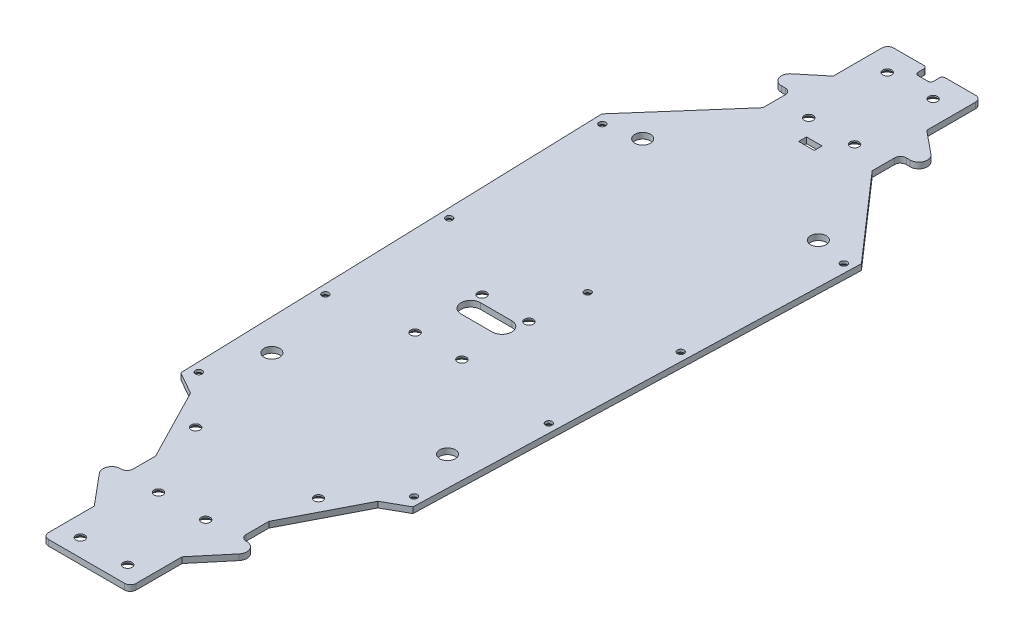
from build123d import *

# Parameters (mm, degrees)
RESSALTO_EXTRUS_O1_DEPTH             = 3
ESBO_O2_R                            = 4
CORTE_EXTRUS_O1_DEPTH                = 10
ESCAREADO_PARA_SFHCS_M31_AT_2_COUNT  = 2
ESCAREADO_PARA_SFHCS_M31_AT_2_PITCH  = 110.302460898
ESCAREADO_PARA_SFHCS_M31_AT_3_COUNT  = 2
ESCAREADO_PARA_SFHCS_M31_AT_3_PITCH  = 130.842986965
ESCAREADO_PARA_SFHCS_M31_AT_4_COUNT  = 2
ESCAREADO_PARA_SFHCS_M31_AT_4_PITCH  = 67
ESCAREADO_PARA_SFHCS_M31_AT_5_COUNT  = 2
ESCAREADO_PARA_SFHCS_M31_AT_5_PITCH  = 132.532334398
ESCAREADO_PARA_SFHCS_M31_AT_6_COUNT  = 2
ESCAREADO_PARA_SFHCS_M31_AT_6_PITCH  = 175.070818678
ESCAREADO_PARA_SFHCS_M31_AT_7_COUNT  = 2
ESCAREADO_PARA_SFHCS_M31_AT_7_PITCH  = 213.572320447
ESCAREADO_PARA_SFHCS_M31_AT_8_COUNT  = 2
ESCAREADO_PARA_SFHCS_M31_AT_8_PITCH  = 243.433045731
ESCAREADO_PARA_SFHCS_M31_AT_9_COUNT  = 2
ESCAREADO_PARA_SFHCS_M31_AT_9_PITCH  = 142.710342559
ESCAREADO_PARA_SFHCS_M41_AT_2_COUNT  = 2
ESCAREADO_PARA_SFHCS_M41_AT_2_PITCH  = 40
ESCAREADO_PARA_SFHCS_M41_AT_3_COUNT  = 2
ESCAREADO_PARA_SFHCS_M41_AT_3_PITCH  = 46.75082887
ESCAREADO_PARA_SFHCS_M41_AT_4_COUNT  = 2
ESCAREADO_PARA_SFHCS_M41_AT_4_PITCH  = 24.2
ESCAREADO_PARA_SFHCS_M41_AT_5_COUNT  = 2
ESCAREADO_PARA_SFHCS_M41_AT_5_PITCH  = 58.077850276
ESCAREADO_PARA_SFHCS_M41_AT_6_COUNT  = 2
ESCAREADO_PARA_SFHCS_M41_AT_6_PITCH  = 43.020334562
ESCAREADO_PARA_SFHCS_M41_AT_7_COUNT  = 2
ESCAREADO_PARA_SFHCS_M41_AT_7_PITCH  = 136.807623633
ESCAREADO_PARA_SFHCS_M41_AT_8_COUNT  = 2
ESCAREADO_PARA_SFHCS_M41_AT_8_PITCH  = 139.831145131
ESCAREADO_PARA_SFHCS_M41_AT_9_COUNT  = 2
ESCAREADO_PARA_SFHCS_M41_AT_9_PITCH  = 173.161507104
ESCAREADO_PARA_SFHCS_M41_AT_10_COUNT = 2
ESCAREADO_PARA_SFHCS_M41_AT_10_PITCH = 170.775968029
ESCAREADO_PARA_SFHCS_M41_AT_11_COUNT = 2
ESCAREADO_PARA_SFHCS_M41_AT_11_PITCH = 332.816318971
ESCAREADO_PARA_SFHCS_M41_AT_12_COUNT = 2
ESCAREADO_PARA_SFHCS_M41_AT_12_PITCH = 333.669600313
ESCAREADO_PARA_SFHCS_M41_AT_13_COUNT = 2
ESCAREADO_PARA_SFHCS_M41_AT_13_PITCH = 373.827719057
ESCAREADO_PARA_SFHCS_M41_AT_14_COUNT = 2
ESCAREADO_PARA_SFHCS_M41_AT_14_PITCH = 373.066299115
ESBO_O9_W                            = 8
ESBO_O9_H                            = 4
CORTE_EXTRUS_O2_DEPTH                = 230.077241914


with BuildPart() as part:
    # Esboço1 → Ressalto-extrusão1 (new body)
    with BuildSketch(Plane(origin=(0, 0, 0), x_dir=(1, 0, 0), z_dir=(0, 1, 0))):
        with BuildLine():
            Line((-2.5, 209.375), (2.5, 209.375))
            ThreePointArc((2.5, 209.375), (3.560660172, 209.814339828), (4, 210.875))
            Line((4, 210.875), (4, 213.875))
            ThreePointArc((4, 213.875), (4.439339828, 214.935660172), (5.5, 215.375))
            Line((5.5, 215.375), (21, 215.375))
            ThreePointArc((21, 215.375), (23.121320344, 214.496320344), (24, 212.375))
            Line((24, 212.375), (24, 187.375))
            Line((24, 187.375), (35.808734273, 177.675))
            ThreePointArc((35.808734273, 177.675), (37.1583493, 172.791760303), (33.015886264, 169.875))
            Line((33.015886264, 169.875), (31, 169.875))
            ThreePointArc((31, 169.875), (28.878679656, 168.996320344), (28, 166.875))
            Line((28, 166.875), (28, 155.375))
            Line((28, 155.375), (66.5, 111.375))
            Line((66.5, 111.375), (59.5, -111.375))
            Line((59.5, -111.375), (48, -117.875))
            Line((48, -117.875), (29, -154.770121629))
            Line((29, -154.770121629), (29, -166.370121629))
            ThreePointArc((29, -166.370121629), (29.878679656, -168.491441972), (32, -169.370121629))
            Line((32, -169.370121629), (32.371701685, -169.370121629))
            ThreePointArc((32.371701685, -169.370121629), (36.448422746, -171.9647751), (35.823953384, -176.756634787))
            Line((35.823953384, -176.756634787), (22.5, -192.691999769))
            Line((22.5, -192.691999769), (22.5, -216.191999769))
            ThreePointArc((22.5, -216.191999769), (21.621320344, -218.313320113), (19.5, -219.191999769))
            Line((19.5, -219.191999769), (-19.5, -219.191999769))
            ThreePointArc((-19.5, -219.191999769), (-21.621320344, -218.313320113), (-22.5, -216.191999769))
            Line((-22.5, -216.191999769), (-22.5, -192.691999769))
            Line((-22.5, -192.691999769), (-35.823953384, -176.756634787))
            ThreePointArc((-35.823953384, -176.756634787), (-36.448422746, -171.9647751), (-32.371701685, -169.370121629))
            Line((-32.371701685, -169.370121629), (-32, -169.370121629))
            ThreePointArc((-32, -169.370121629), (-29.878679656, -168.491441972), (-29, -166.370121629))
            Line((-29, -166.370121629), (-29, -154.770121629))
            Line((-29, -154.770121629), (-48, -117.875))
            Line((-48, -117.875), (-59.5, -111.375))
            Line((-59.5, -111.375), (-66.5, 111.375))
            Line((-66.5, 111.375), (-28, 155.375))
            Line((-28, 155.375), (-28, 166.875))
            ThreePointArc((-28, 166.875), (-28.878679656, 168.996320344), (-31, 169.875))
            Line((-31, 169.875), (-33.015886264, 169.875))
            ThreePointArc((-33.015886264, 169.875), (-37.1583493, 172.791760303), (-35.808734273, 177.675))
            Line((-35.808734273, 177.675), (-24, 187.375))
            Line((-24, 187.375), (-24, 212.375))
            ThreePointArc((-24, 212.375), (-23.121320344, 214.496320344), (-21, 215.375))
            Line((-21, 215.375), (-5.5, 215.375))
            ThreePointArc((-5.5, 215.375), (-4.439339828, 214.935660172), (-4, 213.875))
            Line((-4, 213.875), (-4, 210.875))
            ThreePointArc((-4, 210.875), (-3.560660172, 209.814339828), (-2.5, 209.375))
        make_face()
    extrude(amount=RESSALTO_EXTRUS_O1_DEPTH)

    # Esboço2 → Corte-extrusão1 (cut)
    with BuildSketch(Plane(origin=(0, 3, 0), x_dir=(1, 0, 0), z_dir=(0, 1, 0))):
        with Locations(Location((-45, -79.191999769, 0), (0, 0, 270))):
            Circle(ESBO_O2_R)
        with Locations(Location((45, -79.191999769, 0), (0, 0, 270))):
            Circle(ESBO_O2_R)
        with Locations(Location((45, 110.808000231, 0), (0, 0, 270))):
            Circle(ESBO_O2_R)
        with Locations(Location((-45, 110.808000231, 0), (0, 0, 270))):
            Circle(ESBO_O2_R)
    extrude(amount=-CORTE_EXTRUS_O1_DEPTH, mode=Mode.SUBTRACT)

    # Esboço6 → Escareado para SFHCS M31 (revolve, cut)
    with BuildSketch(Plane(origin=(55.151230449, 0, 106.491941439), x_dir=(0, 0, -1), z_dir=(1, 0, 0))):
        Polygon((0, 0), (0, 3), (1.7, 3), (1.7, 1.66), (3.36, 0), align=None)
    escareado_para_sfhcs_m31 = revolve(axis=Axis((55.151230449, -6.35, 106.491941439), (0, 1, 0)), mode=Mode.SUBTRACT)

    # Escareado para SFHCS M31 at 2: Escareado para SFHCS M31 ×2
    with Locations(*[(-i * ESCAREADO_PARA_SFHCS_M31_AT_2_PITCH, 0, 0) for i in range(1, ESCAREADO_PARA_SFHCS_M31_AT_2_COUNT)]):
        add(escareado_para_sfhcs_m31, mode=Mode.SUBTRACT)

    # Escareado para SFHCS M31 at 3: Escareado para SFHCS M31 ×2
    with Locations(*[Vector(-0.8590977939862314, 0, -0.5118114695549434) * (i * ESCAREADO_PARA_SFHCS_M31_AT_3_PITCH) for i in range(1, ESCAREADO_PARA_SFHCS_M31_AT_3_COUNT)]):
        add(escareado_para_sfhcs_m31, mode=Mode.SUBTRACT)

    # Escareado para SFHCS M31 at 4: Escareado para SFHCS M31 ×2
    with Locations(*[Vector(0.031409859126967435, 0, -0.9995065886474306) * (i * ESCAREADO_PARA_SFHCS_M31_AT_4_PITCH) for i in range(1, ESCAREADO_PARA_SFHCS_M31_AT_4_COUNT)]):
        add(escareado_para_sfhcs_m31, mode=Mode.SUBTRACT)

    # Escareado para SFHCS M31 at 5: Escareado para SFHCS M31 ×2
    with Locations(*[Vector(0.03140985912696758, 0, -0.9995065886474307) * (i * ESCAREADO_PARA_SFHCS_M31_AT_5_PITCH) for i in range(1, ESCAREADO_PARA_SFHCS_M31_AT_5_COUNT)]):
        add(escareado_para_sfhcs_m31, mode=Mode.SUBTRACT)

    # Escareado para SFHCS M31 at 6: Escareado para SFHCS M31 ×2
    with Locations(*[Vector(-0.6538227427961019, 0, -0.7566477522616337) * (i * ESCAREADO_PARA_SFHCS_M31_AT_6_PITCH) for i in range(1, ESCAREADO_PARA_SFHCS_M31_AT_6_COUNT)]):
        add(escareado_para_sfhcs_m31, mode=Mode.SUBTRACT)

    # Escareado para SFHCS M31 at 7: Escareado para SFHCS M31 ×2
    with Locations(*[Vector(0.03140985912696757, 0, -0.9995065886474307) * (i * ESCAREADO_PARA_SFHCS_M31_AT_7_PITCH) for i in range(1, ESCAREADO_PARA_SFHCS_M31_AT_7_COUNT)]):
        add(escareado_para_sfhcs_m31, mode=Mode.SUBTRACT)

    # Escareado para SFHCS M31 at 8: Escareado para SFHCS M31 ×2
    with Locations(*[Vector(-0.4806690769772822, 0, -0.8769020688981225) * (i * ESCAREADO_PARA_SFHCS_M31_AT_8_PITCH) for i in range(1, ESCAREADO_PARA_SFHCS_M31_AT_8_COUNT)]):
        add(escareado_para_sfhcs_m31, mode=Mode.SUBTRACT)

    # Escareado para SFHCS M31 at 9: Escareado para SFHCS M31 ×2
    with Locations(*[Vector(-0.3228941175011494, 0, -0.9464350949130923) * (i * ESCAREADO_PARA_SFHCS_M31_AT_9_PITCH) for i in range(1, ESCAREADO_PARA_SFHCS_M31_AT_9_COUNT)]):
        add(escareado_para_sfhcs_m31, mode=Mode.SUBTRACT)

    # Esboço8 → Escareado para SFHCS M41 (revolve, cut)
    with BuildSketch(Plane(origin=(12.1, 0, 170.191999769), x_dir=(0, 0, -1), z_dir=(1, 0, 0))):
        Polygon((0, 0), (0, 3), (2.25, 3), (2.25, 2.23), (4.48, 0), align=None)
    escareado_para_sfhcs_m41 = revolve(axis=Axis((12.1, -6.35, 170.191999769), (0, 1, 0)), mode=Mode.SUBTRACT)

    # Escareado para SFHCS M41 at 2: Escareado para SFHCS M41 ×2
    with Locations(*[(0, 0, i * ESCAREADO_PARA_SFHCS_M41_AT_2_PITCH) for i in range(1, ESCAREADO_PARA_SFHCS_M41_AT_2_COUNT)]):
        add(escareado_para_sfhcs_m41, mode=Mode.SUBTRACT)

    # Escareado para SFHCS M41 at 3: Escareado para SFHCS M41 ×2
    with Locations(*[Vector(-0.5176378811907321, 0, 0.8555998036210444) * (i * ESCAREADO_PARA_SFHCS_M41_AT_3_PITCH) for i in range(1, ESCAREADO_PARA_SFHCS_M41_AT_3_COUNT)]):
        add(escareado_para_sfhcs_m41, mode=Mode.SUBTRACT)

    # Escareado para SFHCS M41 at 4: Escareado para SFHCS M41 ×2
    with Locations(*[(-i * ESCAREADO_PARA_SFHCS_M41_AT_4_PITCH, 0, 0) for i in range(1, ESCAREADO_PARA_SFHCS_M41_AT_4_COUNT)]):
        add(escareado_para_sfhcs_m41, mode=Mode.SUBTRACT)

    # Escareado para SFHCS M41 at 5: Escareado para SFHCS M41 ×2
    with Locations(*[Vector(-0.7498938236983096, 0, -0.6615582009008192) * (i * ESCAREADO_PARA_SFHCS_M41_AT_5_PITCH) for i in range(1, ESCAREADO_PARA_SFHCS_M41_AT_5_COUNT)]):
        add(escareado_para_sfhcs_m41, mode=Mode.SUBTRACT)

    # Escareado para SFHCS M41 at 6: Escareado para SFHCS M41 ×2
    with Locations(*[Vector(0.44983892878661463, 0, -0.8931097010715487) * (i * ESCAREADO_PARA_SFHCS_M41_AT_6_PITCH) for i in range(1, ESCAREADO_PARA_SFHCS_M41_AT_6_COUNT)]):
        add(escareado_para_sfhcs_m41, mode=Mode.SUBTRACT)

    # Escareado para SFHCS M41 at 7: Escareado para SFHCS M41 ×2
    with Locations(*[Vector(-0.039657765677978324, 0, -0.999213321379089) * (i * ESCAREADO_PARA_SFHCS_M41_AT_7_PITCH) for i in range(1, ESCAREADO_PARA_SFHCS_M41_AT_7_COUNT)]):
        add(escareado_para_sfhcs_m41, mode=Mode.SUBTRACT)

    # Escareado para SFHCS M41 at 8: Escareado para SFHCS M41 ×2
    with Locations(*[Vector(-0.21043584140980087, 0, -0.9776076701060344) * (i * ESCAREADO_PARA_SFHCS_M41_AT_8_PITCH) for i in range(1, ESCAREADO_PARA_SFHCS_M41_AT_8_COUNT)]):
        add(escareado_para_sfhcs_m41, mode=Mode.SUBTRACT)

    # Escareado para SFHCS M41 at 9: Escareado para SFHCS M41 ×2
    with Locations(*[Vector(-0.16801225891576932, 0, -0.9857849059779829) * (i * ESCAREADO_PARA_SFHCS_M41_AT_9_PITCH) for i in range(1, ESCAREADO_PARA_SFHCS_M41_AT_9_COUNT)]):
        add(escareado_para_sfhcs_m41, mode=Mode.SUBTRACT)

    # Escareado para SFHCS M41 at 10: Escareado para SFHCS M41 ×2
    with Locations(*[Vector(-0.0298241961363705, 0, -0.9995551597209728) * (i * ESCAREADO_PARA_SFHCS_M41_AT_10_PITCH) for i in range(1, ESCAREADO_PARA_SFHCS_M41_AT_10_COUNT)]):
        add(escareado_para_sfhcs_m41, mode=Mode.SUBTRACT)

    # Escareado para SFHCS M41 at 11: Escareado para SFHCS M41 ×2
    with Locations(*[Vector(-0.0010516311251878737, 0, -0.9999994470358354) * (i * ESCAREADO_PARA_SFHCS_M41_AT_11_PITCH) for i in range(1, ESCAREADO_PARA_SFHCS_M41_AT_11_COUNT)]):
        add(escareado_para_sfhcs_m41, mode=Mode.SUBTRACT)

    # Escareado para SFHCS M41 at 12: Escareado para SFHCS M41 ×2
    with Locations(*[Vector(-0.0714778930343451, 0, -0.9974421841928337) * (i * ESCAREADO_PARA_SFHCS_M41_AT_12_PITCH) for i in range(1, ESCAREADO_PARA_SFHCS_M41_AT_12_COUNT)]):
        add(escareado_para_sfhcs_m41, mode=Mode.SUBTRACT)

    # Escareado para SFHCS M41 at 13: Escareado para SFHCS M41 ×2
    with Locations(*[Vector(-0.06379944232106374, 0, -0.9979627403663532) * (i * ESCAREADO_PARA_SFHCS_M41_AT_13_PITCH) for i in range(1, ESCAREADO_PARA_SFHCS_M41_AT_13_COUNT)]):
        add(escareado_para_sfhcs_m41, mode=Mode.SUBTRACT)

    # Escareado para SFHCS M41 at 14: Escareado para SFHCS M41 ×2
    with Locations(*[Vector(-0.0009381710458172143, 0, -0.9999995599174476) * (i * ESCAREADO_PARA_SFHCS_M41_AT_14_PITCH) for i in range(1, ESCAREADO_PARA_SFHCS_M41_AT_14_COUNT)]):
        add(escareado_para_sfhcs_m41, mode=Mode.SUBTRACT)

    # Esboço9 → Corte-extrusão2 (cut, through all)
    with BuildSketch(Plane.XZ):
        with BuildLine():
            Line((-13.794262039, 13.491999769), (2.205737961, 13.491999769))
            ThreePointArc((2.205737961, 13.491999769), (7.205737961, 8.491999769), (2.205737961, 3.491999769))
            Line((2.205737961, 3.491999769), (-13.794262039, 3.491999769))
            ThreePointArc((-13.794262039, 3.491999769), (-18.794262039, 8.491999769), (-13.794262039, 13.491999769))
        make_face()
        with Locations((0.15, -151.574135166)):
            Rectangle(ESBO_O9_W, ESBO_O9_H)
    extrude(amount=-CORTE_EXTRUS_O2_DEPTH, mode=Mode.SUBTRACT)


solid = part.part
